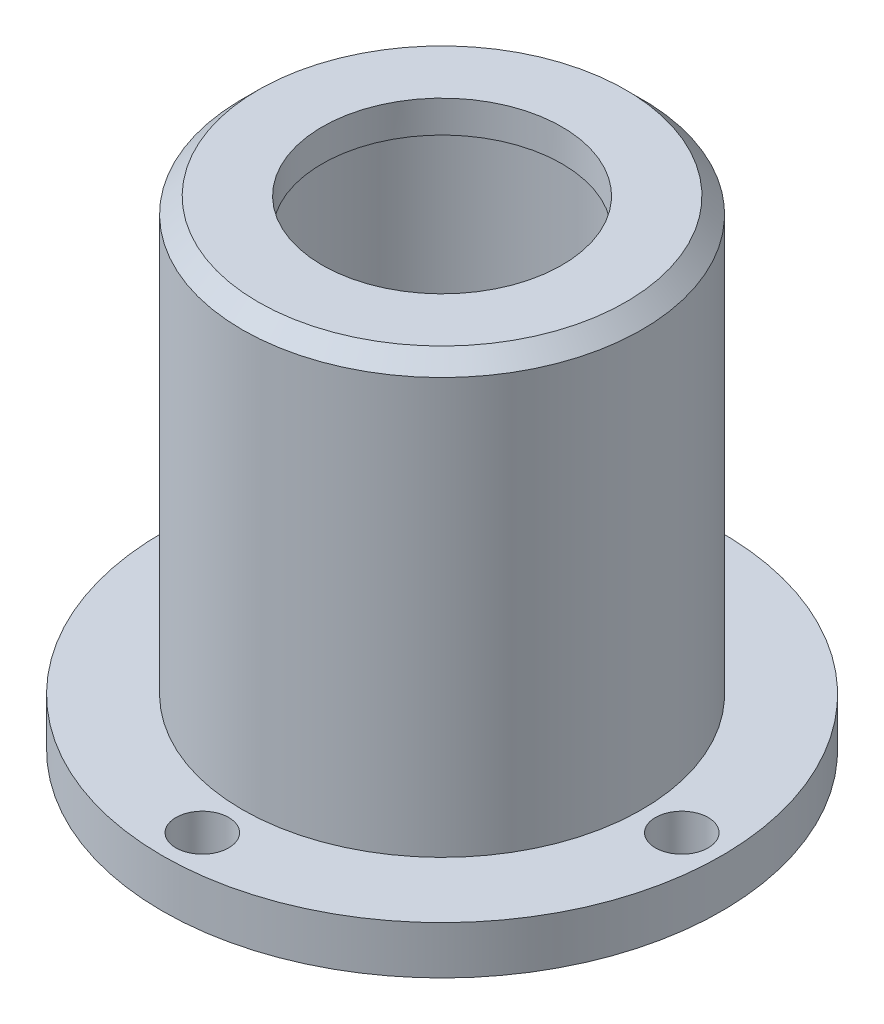
from build123d import *

# Parameters (mm, degrees)
SKETCH_1_R          = 17.5
EXTRUDE_1_DEPTH     = 3
SKETCH_2_R          = 12.5
EXTRUDE_2_DEPTH     = 27
SKETCH_4_R          = 9.5
CUT_EXTRUDE_1_DEPTH = 28
SKETCH_5_R          = 7.5
CUT_EXTRUDE_2_DEPTH = 28
CHAMFER_1_SIZE      = 1
SKETCH_6_R          = 1.65
CUT_EXTRUDE_3_DEPTH = 10


with BuildPart() as part:
    # Эскиз1 → Бобышка-Вытянуть1 (new body)
    with BuildSketch(Plane(origin=(0, 0, 0), x_dir=(1, 0, 0), z_dir=(0, 1, 0))):
        with Locations(Location((0, 0, 0), (0, 0, 270))):
            Circle(SKETCH_1_R)
    extrude(amount=EXTRUDE_1_DEPTH)

    # Эскиз2 → Бобышка-Вытянуть2 (add)
    with BuildSketch(Plane(origin=(0, 3, 0), x_dir=(1, 0, 0), z_dir=(0, 1, 0))):
        with Locations(Location((0, 0, 0), (0, 0, 270))):
            Circle(SKETCH_2_R)
    extrude(amount=EXTRUDE_2_DEPTH)

    # Эскиз4 → Вырез-Вытянуть1 (cut)
    with BuildSketch(Plane.XZ):
        with Locations(Location((0, 0, 0), (0, 0, 270))):
            Circle(SKETCH_4_R)
    extrude(amount=-CUT_EXTRUDE_1_DEPTH, mode=Mode.SUBTRACT)

    # Эскиз5 → Вырез-Вытянуть2 (cut)
    with BuildSketch(Plane(origin=(0, 30, 0), x_dir=(1, 0, 0), z_dir=(0, 1, 0))):
        with Locations(Location((0, 0, 0), (0, 0, 270))):
            Circle(SKETCH_5_R)
    extrude(amount=-CUT_EXTRUDE_2_DEPTH, mode=Mode.SUBTRACT)

    # Фаска1
    chamfer_1_edges = [part.edges().sort_by_distance(p)[0] for p in [
        (0, 30, -12.5),
    ]]
    chamfer(chamfer_1_edges, length=CHAMFER_1_SIZE)

    # Эскиз6 → Вырез-Вытянуть3 (cut)
    with BuildSketch(Plane.XZ):
        with Locations(Location((0, 15, 0), (0, 0, 270))):
            Circle(SKETCH_6_R)
        with Locations(Location((-15, 0, 0), (0, 0, 270))):
            Circle(SKETCH_6_R)
        with Locations(Location((0, -15, 0), (0, 0, 270))):
            Circle(SKETCH_6_R)
        with Locations(Location((15, 0, 0), (0, 0, 270))):
            Circle(SKETCH_6_R)
    extrude(amount=-CUT_EXTRUDE_3_DEPTH, mode=Mode.SUBTRACT)


solid = part.part
